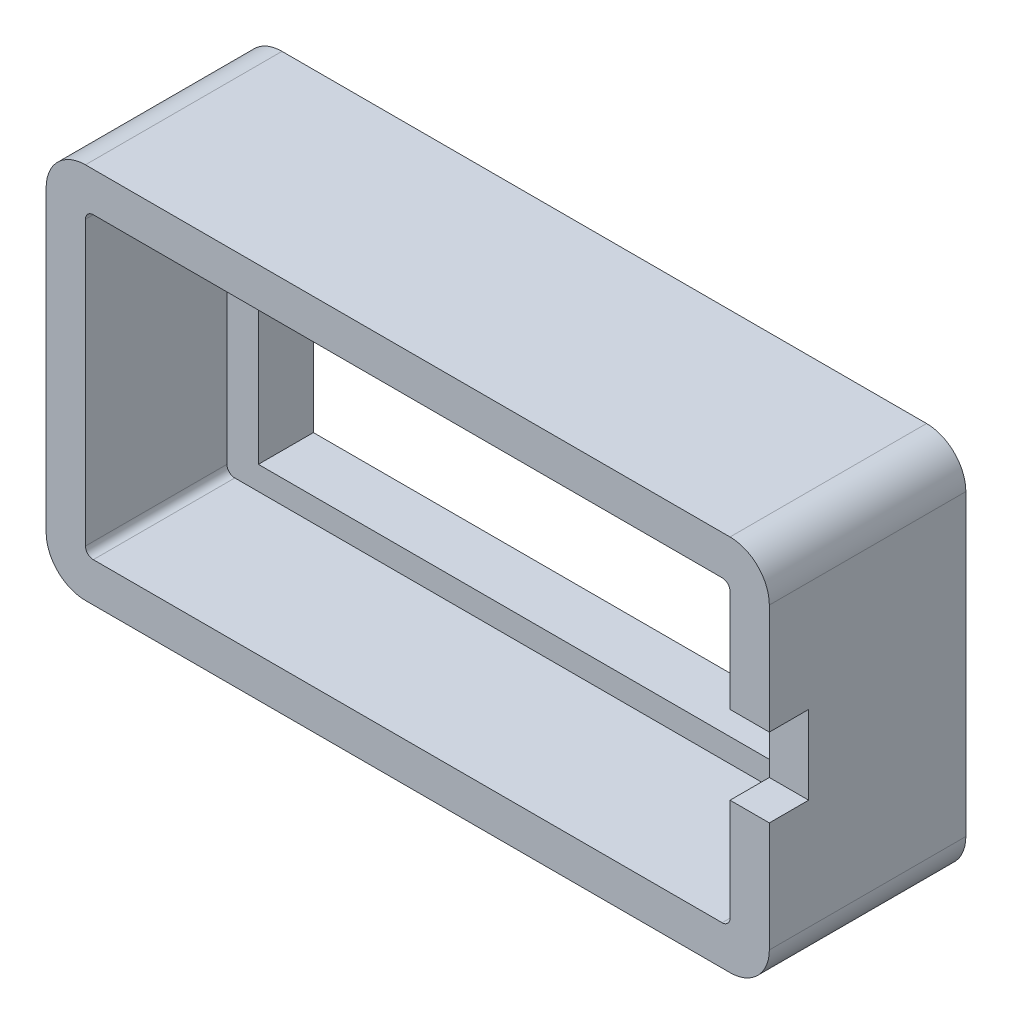
from build123d import *

# Parameters (mm, degrees)
CROQUIS7_W              = 92
CROQUIS7_H              = 48
CROQUIS7_W_2            = 74
CROQUIS7_H_2            = 29
SALIENTE_EXTRUIR5_DEPTH = 25
CROQUIS8_W              = 82
CROQUIS8_H              = 38
CORTAR_EXTRUIR3_DEPTH   = 18
REDONDEO1_R             = 5
REDONDEO2_R             = 1
CROQUIS10_W             = 10
CROQUIS10_H             = 10
CORTAR_EXTRUIR4_DEPTH   = 20


with BuildPart() as part:
    # Croquis7 → Saliente-Extruir5 (new body)
    with BuildSketch(Plane.XY):
        with Locations((37, -13)):
            Rectangle(CROQUIS7_W, CROQUIS7_H)
        with Locations((37, -14.5)):
            Rectangle(CROQUIS7_W_2, CROQUIS7_H_2, mode=Mode.SUBTRACT)
    extrude(amount=SALIENTE_EXTRUIR5_DEPTH)

    # Croquis8 → Cortar-Extruir3 (cut)
    with BuildSketch(Plane.XY.offset(25)):
        with Locations((37, -13)):
            Rectangle(CROQUIS8_W, CROQUIS8_H)
    extrude(amount=-CORTAR_EXTRUIR3_DEPTH, mode=Mode.SUBTRACT)

    # Redondeo1
    redondeo1_edges = [part.edges().sort_by_distance(p)[0] for p in [
        (-9, 11, 12.5),
        (83, 11, 12.5),
        (83, -37, 12.5),
        (-9, -37, 12.5),
    ]]
    fillet(redondeo1_edges, radius=REDONDEO1_R)

    # Redondeo2
    redondeo2_edges = [part.edges().sort_by_distance(p)[0] for p in [
        (-4, -32, 16),
        (-4, 6, 16),
        (78, 6, 16),
        (78, -32, 16),
    ]]
    fillet(redondeo2_edges, radius=REDONDEO2_R)

    # Croquis10 → Cortar-Extruir4 (cut)
    with BuildSketch(Plane(origin=(83, 0, 0), x_dir=(0, 0, -1), z_dir=(1, 0, 0))):
        with Locations((-25, -13)):
            Rectangle(CROQUIS10_W, CROQUIS10_H)
    extrude(amount=-CORTAR_EXTRUIR4_DEPTH, mode=Mode.SUBTRACT)


solid = part.part
